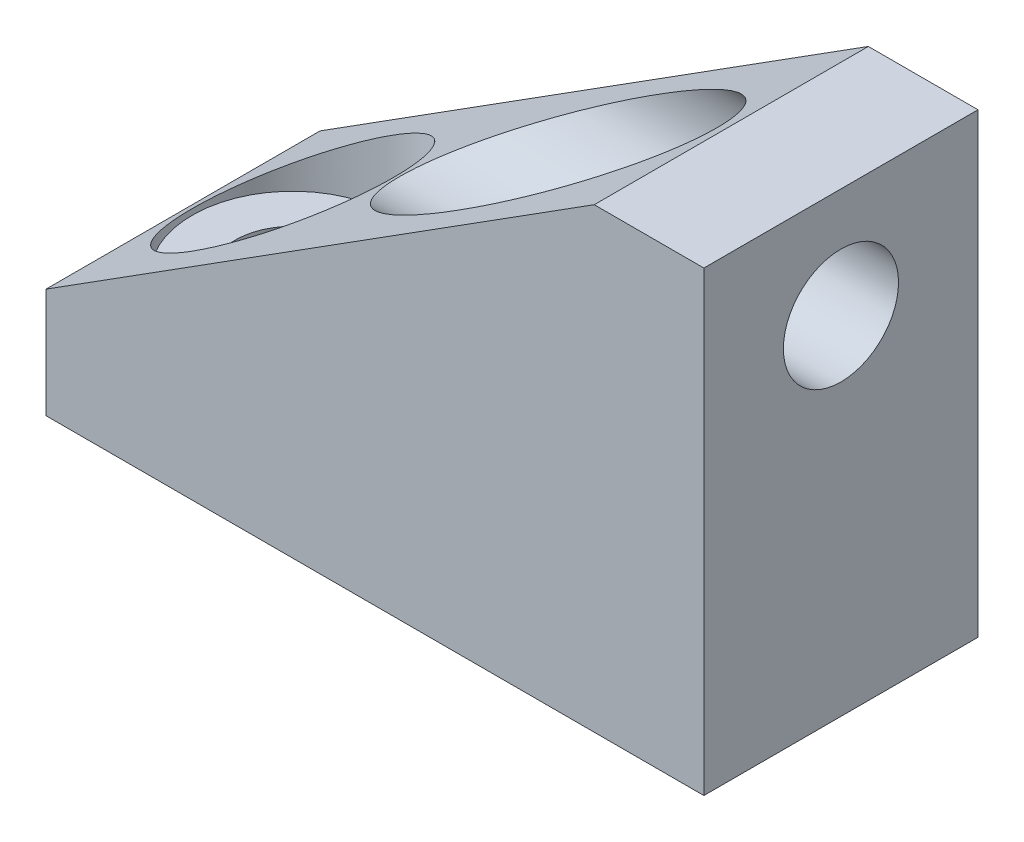
from build123d import *

# Parameters (mm, degrees)
BOSS_EXTRUDE2_DEPTH = 15
SKETCH4_R           = 3.15
CUT_EXTRUDE1_DEPTH  = 46.776415929
SKETCH4_3_R         = 5.5
SKETCH4_3_R_2       = 3.15
CUT_EXTRUDE2_DEPTH  = 14
SKETCH6_R           = 3.15
CUT_EXTRUDE3_DEPTH  = 49.171363436
SKETCH6_3_R         = 5.5
SKETCH6_3_R_2       = 3.15
CUT_EXTRUDE4_DEPTH  = 32.34684153


with BuildPart() as part:
    # Sketch3 → Boss-Extrude2 (new body)
    with BuildSketch(Plane.XY):
        Polygon((2.34684153, 0), (38.34684153, 0), (38.34684153, 25), (32.34684153, 25), (2.34684153, 6), align=None)
    extrude(amount=BOSS_EXTRUDE2_DEPTH)

    # Sketch4 → Cut-Extrude1 (cut, through all)
    with BuildSketch(Plane(origin=(0, 20, 0), x_dir=(1, 0, 0), z_dir=(0, 1, 0))):
        with Locations(Location((8.34684153, -7.5, 0), (0, 0, 270))):
            Circle(SKETCH4_R)
    extrude(amount=-CUT_EXTRUDE1_DEPTH, mode=Mode.SUBTRACT)

    # Sketch4<3> → Cut-Extrude2 (cut)
    with BuildSketch(Plane(origin=(0, 20, 0), x_dir=(1, 0, 0), z_dir=(0, 1, 0))):
        with Locations(Location((8.34684153, -7.5, 0), (0, 0, 270))):
            Circle(SKETCH4_3_R)
        with Locations(Location((8.34684153, -7.5, 0), (0, 0, 270))):
            Circle(SKETCH4_3_R_2, mode=Mode.SUBTRACT)
    extrude(amount=-CUT_EXTRUDE2_DEPTH, mode=Mode.SUBTRACT)

    # Sketch6 → Cut-Extrude3 (cut, through all)
    with BuildSketch(Plane(origin=(0, 0, 0), x_dir=(0, 0, -1), z_dir=(1, 0, 0))):
        with Locations(Location((-7.5, 19, 0), (0, 0, 270))):
            Circle(SKETCH6_R)
    extrude(amount=CUT_EXTRUDE3_DEPTH, mode=Mode.SUBTRACT)

    # Sketch6<3> → Cut-Extrude4 (cut)
    with BuildSketch(Plane(origin=(0, 0, 0), x_dir=(0, 0, -1), z_dir=(1, 0, 0))):
        with Locations(Location((-7.5, 19, 0), (0, 0, 180))):
            Circle(SKETCH6_3_R)
        with Locations(Location((-7.5, 19, 0), (0, 0, 180))):
            Circle(SKETCH6_3_R_2, mode=Mode.SUBTRACT)
    extrude(amount=CUT_EXTRUDE4_DEPTH, mode=Mode.SUBTRACT)


solid = part.part
